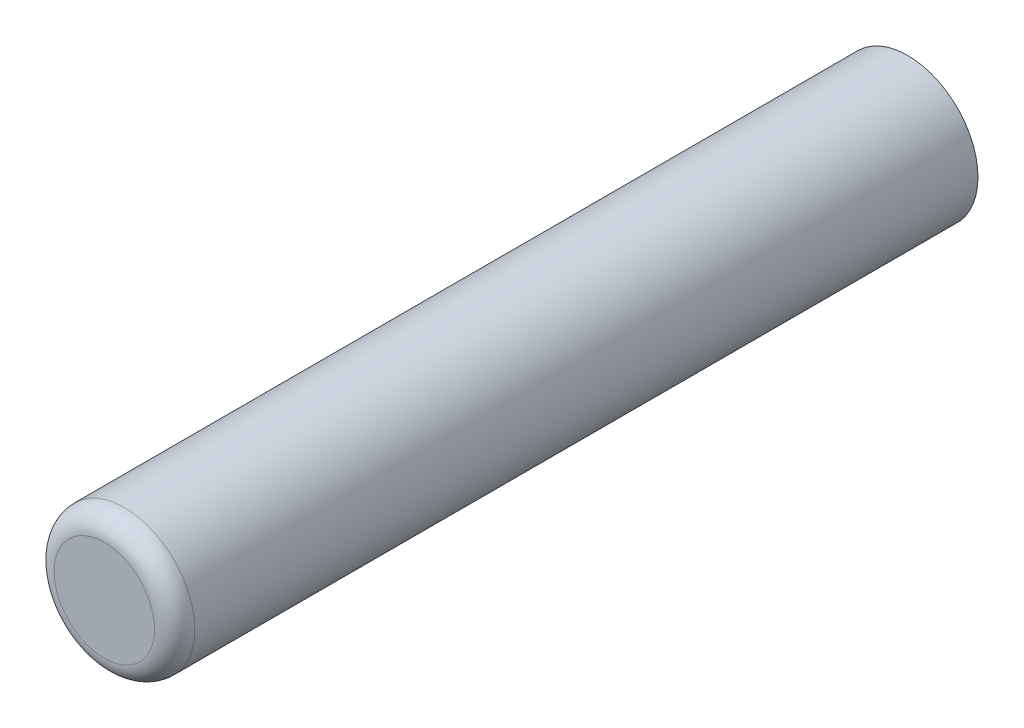
from build123d import *

# Parameters (mm, degrees)
ESBO_O2_R                = 1.75
RESSALTO_EXTRUS_O1_DEPTH = 9.3
ESBO_O3_R                = 1.75
RESSALTO_EXTRUS_O2_DEPTH = 10.7
FILETE1_R                = 0.5


with BuildPart() as part:
    # Esboço2 → Ressalto-extrusão1 (new body)
    with BuildSketch(Plane.XY):
        with Locations((0, 0.25)):
            Circle(ESBO_O2_R)
        with BuildLine():
            Line((1.118033989, 1.25), (-1.118033989, 1.25))
            ThreePointArc((-1.118033989, 1.25), (0, -1.25), (1.118033989, 1.25))
        make_face(mode=Mode.SUBTRACT)
    extrude(amount=RESSALTO_EXTRUS_O1_DEPTH)

    # Esboço3 → Ressalto-extrusão2 (add)
    with BuildSketch(Plane.XY.offset(9.3)):
        with Locations((0, 0.25)):
            Circle(ESBO_O3_R)
    extrude(amount=RESSALTO_EXTRUS_O2_DEPTH)

    # Filete1
    filete1_edges = [part.edges().sort_by_distance(p)[0] for p in [
        (-1.75, 0.25, 20),
    ]]
    fillet(filete1_edges, radius=FILETE1_R)


solid = part.part
